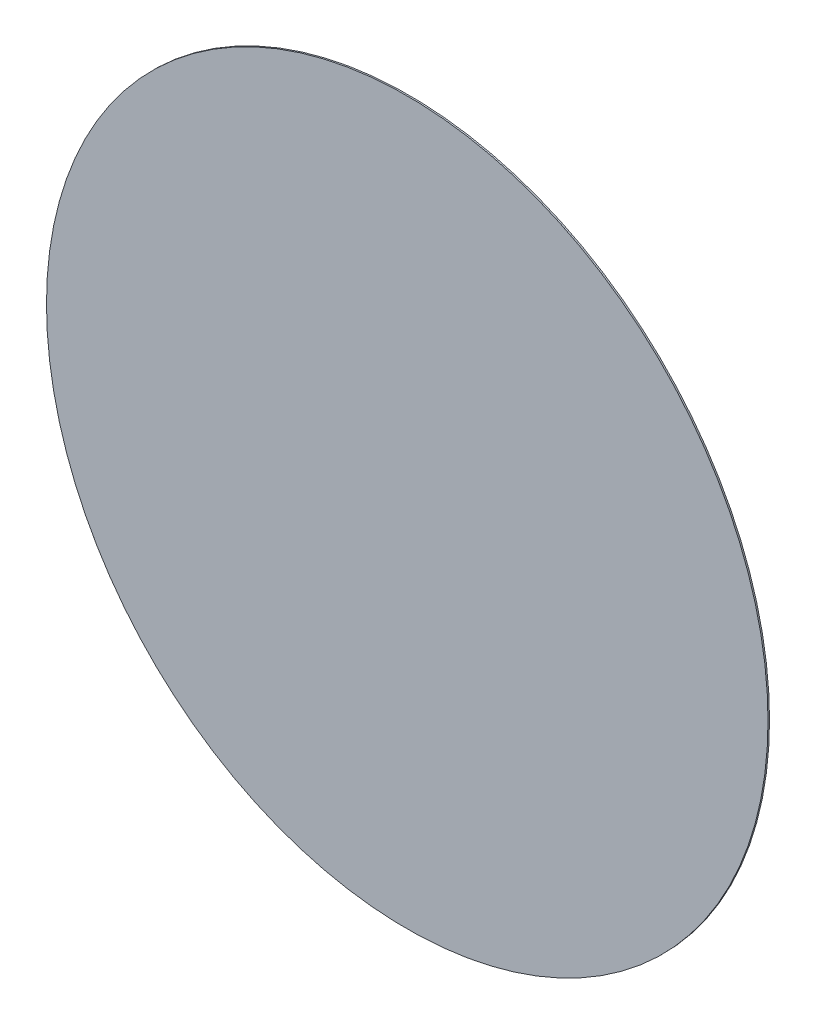
from build123d import *

# Parameters (mm, degrees)
SKETCH2_R           = 47.75
BOSS_EXTRUDE1_DEPTH = 0.2


with BuildPart() as part:
    # Sketch2 → Boss-Extrude1 (new body)
    with BuildSketch(Plane.XY):
        Circle(SKETCH2_R)
    extrude(amount=BOSS_EXTRUDE1_DEPTH)


solid = part.part
